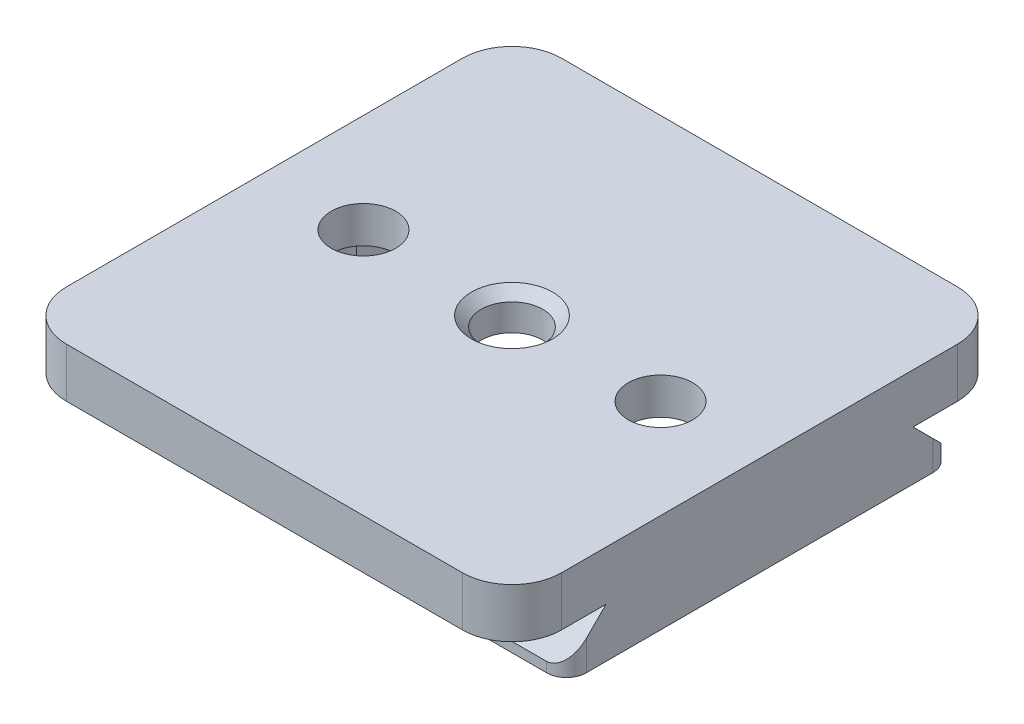
from build123d import *

# Parameters (mm, degrees)
SKETCH1_W           = 50
SKETCH1_H           = 50
BOSS_EXTRUDE1_DEPTH = 10
CUT_EXTRUDE3_DEPTH  = 6.3
SKETCH5_R           = 6.5
SKETCH5_R_2         = 3.1
BOSS_EXTRUDE2_DEPTH = 0.5
CUT_EXTRUDE4_DEPTH  = 57.789083458
FILLET2_R           = 5
CHAMFER2_SIZE       = 1
CHAMFER2_SIZE2      = 1.414213562
FILLET3_R           = 2
SKETCH9_R           = 3.1
CUT_EXTRUDE5_DEPTH  = 36.912254176
CHAMFER3_SIZE       = 1
SKETCH10_W          = 52
SKETCH10_H          = 19.709433282
CUT_EXTRUDE6_DEPTH  = 6.3
SKETCH14_R          = 3.25
CUT_EXTRUDE7_DEPTH  = 10
SKETCH15_W          = 4
SKETCH15_H          = 19.709433282
BOSS_EXTRUDE5_DEPTH = 6.3
SKETCH16_R          = 8
CUT_EXTRUDE8_DEPTH  = 10


with BuildPart() as part:
    # Sketch1 → Boss-Extrude1 (new body)
    with BuildSketch(Plane(origin=(0, 0, 0), x_dir=(1, 0, 0), z_dir=(0, 1, 0))):
        Rectangle(SKETCH1_W, SKETCH1_H)
    extrude(amount=BOSS_EXTRUDE1_DEPTH)

    # Sketch4 → Cut-Extrude3 (cut)
    with BuildSketch(Plane(origin=(0, 0, 0), x_dir=(-1, 0, 0), z_dir=(0, -1, 0))):
        with BuildLine():
            Line((21, -7.228416147), (21, -10.5))
            ThreePointArc((21, -10.5), (20.267766953, -12.267766953), (18.5, -13))
            Line((18.5, -13), (-18.5, -13))
            ThreePointArc((-18.5, -13), (-20.267766953, -12.267766953), (-21, -10.5))
            Line((-21, -10.5), (-21, -7.228416147))
            ThreePointArc((-21, -7.228416147), (-20.591644852, -6.017356006), (-19.533333333, -5.300838508))
            ThreePointArc((-19.533333333, -5.300838508), (-15.5, 0), (-19.533333333, 5.300838508))
            ThreePointArc((-19.533333333, 5.300838508), (-20.591644852, 6.017356006), (-21, 7.228416147))
            Line((-21, 7.228416147), (-21, 10.5))
            ThreePointArc((-21, 10.5), (-20.267766953, 12.267766953), (-18.5, 13))
            Line((-18.5, 13), (18.5, 13))
            ThreePointArc((18.5, 13), (20.267766953, 12.267766953), (21, 10.5))
            Line((21, 10.5), (21, 7.228416147))
            ThreePointArc((21, 7.228416147), (20.591644852, 6.017356006), (19.533333333, 5.300838508))
            ThreePointArc((19.533333333, 5.300838508), (15.5, 0), (19.533333333, -5.300838508))
            ThreePointArc((19.533333333, -5.300838508), (20.591644852, -6.017356006), (21, -7.228416147))
        make_face()
    extrude(amount=-CUT_EXTRUDE3_DEPTH, mode=Mode.SUBTRACT)

    # Sketch5 → Boss-Extrude2 (add)
    with BuildSketch(Plane(origin=(0, 6.3, 0), x_dir=(-1, 0, 0), z_dir=(0, -1, 0))):
        with Locations(Location((0, 0, 0), (0, 0, 90))):
            Circle(SKETCH5_R)
        with Locations(Location((0, 0, 0), (0, 0, 90))):
            Circle(SKETCH5_R_2, mode=Mode.SUBTRACT)
    extrude(amount=BOSS_EXTRUDE2_DEPTH)

    # Sketch8 → Cut-Extrude4 (cut, through all)
    with BuildSketch(Plane(origin=(25, 0, 0), x_dir=(0, 0, -1), z_dir=(1, 0, 0))):
        Polygon((-25, 0), (-25, 5), (-15.5, 5), (-20.5, 0), align=None)
        Polygon((25, 0), (25, 5), (15.5, 5), (20.5, 0), align=None)
    extrude(amount=-CUT_EXTRUDE4_DEPTH, mode=Mode.SUBTRACT)

    # Fillet2
    fillet2_edges = [part.edges().sort_by_distance(p)[0] for p in [
        (-25, 7.5, -25),
        (25, 7.5, -25),
        (25, 7.5, 25),
        (-25, 7.5, 25),
    ]]
    fillet(fillet2_edges, radius=FILLET2_R)

    # Chamfer2
    chamfer2_edges = [part.edges().sort_by_distance(p)[0] for p in [
        (0, 0, 20.5),
        (0, 0, -20.5),
    ]]
    chamfer2_side = [part.faces().sort_by_distance(p)[0] for p in [
        (24.353393474, 0, 0),
    ]]
    chamfer(chamfer2_edges, length=CHAMFER2_SIZE, length2=CHAMFER2_SIZE2, reference=chamfer2_side[0])

    # Fillet3
    fillet3_edges = [part.edges().sort_by_distance(p)[0] for p in [
        (25, 0.5, -19.5),
        (25, 0.5, 19.5),
        (-25, 0.5, -19.5),
        (-25, 0.5, 19.5),
    ]]
    fillet(fillet3_edges, radius=FILLET3_R)

    # Sketch9 → Cut-Extrude5 (cut, through all)
    with BuildSketch(Plane(origin=(0, 6.3, 0), x_dir=(-1, 0, 0), z_dir=(0, -1, 0))):
        with Locations(Location((0, 0, 0), (0, 0, 90))):
            Circle(SKETCH9_R)
    extrude(amount=-CUT_EXTRUDE5_DEPTH, mode=Mode.SUBTRACT)

    # Chamfer3
    chamfer3_edges = [part.edges().sort_by_distance(p)[0] for p in [
        (0, 10, 3.1),
    ]]
    chamfer(chamfer3_edges, length=CHAMFER3_SIZE)

    # Sketch10 → Cut-Extrude6 (cut)
    with BuildSketch(Plane.XZ):
        Rectangle(SKETCH10_W, SKETCH10_H)
    extrude(amount=-CUT_EXTRUDE6_DEPTH, mode=Mode.SUBTRACT)

    # Sketch14 → Cut-Extrude7 (cut)
    with BuildSketch(Plane.XZ.offset(-6.3)):
        with Locations(Location((15, 0, 0), (0, 0, 270))):
            Circle(SKETCH14_R)
        with Locations(Location((-15, 0, 0), (0, 0, 270))):
            Circle(SKETCH14_R)
    extrude(amount=-CUT_EXTRUDE7_DEPTH, mode=Mode.SUBTRACT)

    # Sketch15 → Boss-Extrude5 (add)
    with BuildSketch(Plane(origin=(0, 6.3, 0), x_dir=(-1, 0, 0), z_dir=(0, -1, 0))):
        with Locations((-23, 0)):
            Rectangle(SKETCH15_W, SKETCH15_H)
        with Locations((23, 0)):
            Rectangle(SKETCH15_W, SKETCH15_H)
    extrude(amount=BOSS_EXTRUDE5_DEPTH)

    # Sketch16 → Cut-Extrude8 (cut)
    with BuildSketch(Plane(origin=(0, 6.3, 0), x_dir=(-1, 0, 0), z_dir=(0, -1, 0))):
        with Locations((-15, 0)):
            Circle(SKETCH16_R)
        with Locations((15, 0)):
            Circle(SKETCH16_R)
    extrude(amount=CUT_EXTRUDE8_DEPTH, mode=Mode.SUBTRACT)


solid = part.part
